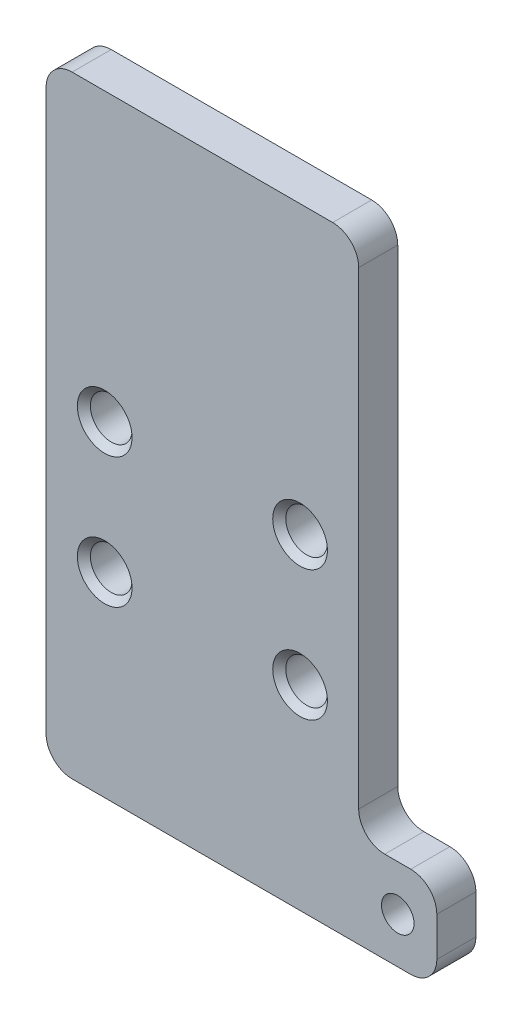
from build123d import *

# Parameters (mm, degrees)
SKETCH_1_R      = 1.6
SKETCH_1_R_2    = 1.25
EXTRUDE_1_DEPTH = 3
CHAMFER_1_SIZE  = 0.5
FILLET_1_R      = 2


with BuildPart() as part:
    # 草图1 → 凸台-拉伸1 (new body)
    with BuildSketch(Plane.XY):
        Polygon((12, -25), (18, -25), (18, -32), (-12, -32), (-12, 15), (12, 15), align=None)
        with Locations((-7.5, -7)):
            Circle(SKETCH_1_R, mode=Mode.SUBTRACT)
        with Locations((7.5, -7)):
            Circle(SKETCH_1_R, mode=Mode.SUBTRACT)
        with Locations((-7.5, -17)):
            Circle(SKETCH_1_R, mode=Mode.SUBTRACT)
        with Locations((7.5, -17)):
            Circle(SKETCH_1_R, mode=Mode.SUBTRACT)
        with Locations((15, -28.5)):
            Circle(SKETCH_1_R_2, mode=Mode.SUBTRACT)
    extrude(amount=EXTRUDE_1_DEPTH)

    # 倒角1
    chamfer_1_edges = [part.edges().sort_by_distance(p)[0] for p in [
        (13.75, -28.5, 0),
        (-9.1, -7, 3),
        (5.9, -7, 3),
        (-9.1, -17, 3),
        (5.9, -17, 3),
    ]]
    chamfer(chamfer_1_edges, length=CHAMFER_1_SIZE)

    # 圆角1
    fillet_1_edges = [part.edges().sort_by_distance(p)[0] for p in [
        (-12, -32, 1.5),
        (-12, 15, 1.5),
        (12, 15, 1.5),
        (12, -25, 1.5),
        (18, -25, 1.5),
        (18, -32, 1.5),
    ]]
    fillet(fillet_1_edges, radius=FILLET_1_R)


solid = part.part
